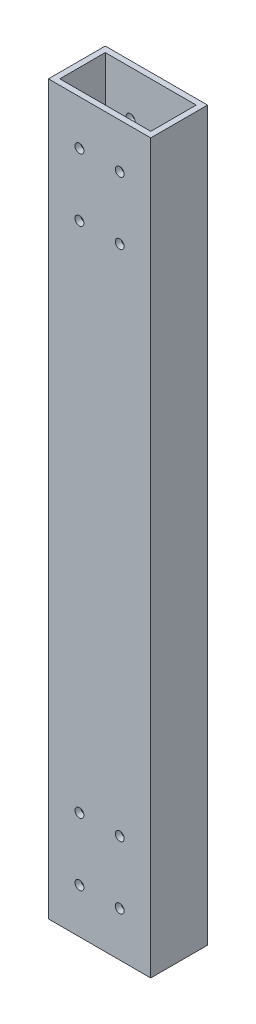
from build123d import *

# Parameters (mm, degrees)
SKETCH1_W           = 57.15
SKETCH1_H           = 31.75
SKETCH1_W_2         = 50.8
SKETCH1_H_2         = 25.4
BOSS_EXTRUDE1_DEPTH = 406.4
SKETCH2_R           = 2.5
CUT_EXTRUDE1_DEPTH  = 409.638658383


with BuildPart() as part:
    # Sketch1 → Boss-Extrude1 (new body)
    with BuildSketch(Plane(origin=(0, 0, 0), x_dir=(1, 0, 0), z_dir=(0, 1, 0))):
        Rectangle(SKETCH1_W, SKETCH1_H)
        Rectangle(SKETCH1_W_2, SKETCH1_H_2, mode=Mode.SUBTRACT)
    extrude(amount=BOSS_EXTRUDE1_DEPTH)

    # Sketch2 → Cut-Extrude1 (cut, through all)
    with BuildSketch(Plane.XY.offset(15.875)):
        with Locations((-11.25, 60)):
            Circle(SKETCH2_R)
        with Locations((-11.25, 25)):
            Circle(SKETCH2_R)
        with Locations((11.25, 25)):
            Circle(SKETCH2_R)
        with Locations((11.25, 60)):
            Circle(SKETCH2_R)
    cut_extrude1 = extrude(amount=-CUT_EXTRUDE1_DEPTH, mode=Mode.SUBTRACT)

    # Mirror1: Cut-Extrude1 across plane
    add(cut_extrude1.mirror(Plane(origin=(0, 203.2, 0), x_dir=(0, 0, 1), z_dir=(0, -1, 0))), mode=Mode.SUBTRACT)


solid = part.part
